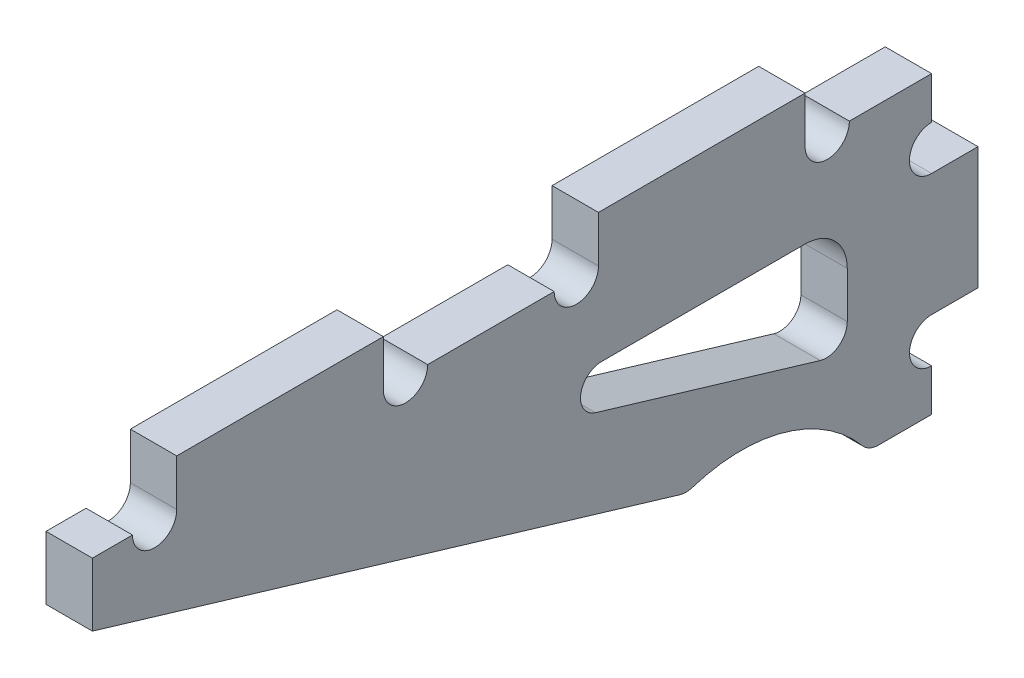
from build123d import *

# Parameters (mm, degrees)
EXTRUDE_1_DEPTH = 2.2
FILLET_1_R      = 2
FILLET_2_R      = 1


with BuildPart() as part:
    # 草图1 → 凸台-拉伸1 (new body)
    with BuildSketch(Plane(origin=(0, 0, 0), x_dir=(0, 0, -1), z_dir=(1, 0, 0))):
        with BuildLine():
            ThreePointArc((7, -1.1), (5.95, -2.15), (4.9, -1.1))
            Line((4.9, -1.1), (4.9, 1.1))
            Line((4.9, 1.1), (-4.9, 1.1))
            Line((-4.9, 1.1), (-4.9, -1.1))
            ThreePointArc((-4.9, -1.1), (-5.95, -2.15), (-7, -1.1))
            Line((-7, -1.1), (-13, -1.1))
            ThreePointArc((-13, -1.1), (-14.05, -2.15), (-15.1, -1.1))
            Line((-15.1, -1.1), (-15.1, 1.1))
            Line((-15.1, 1.1), (-24.9, 1.1))
            Line((-24.9, 1.1), (-24.9, -1.1))
            ThreePointArc((-24.9, -1.1), (-25.95, -2.15), (-27, -1.1))
            Line((-27, -1.1), (-28.9, -1.1))
            Line((-28.9, -1.1), (-28.9, -4.1))
            Line((-28.9, -4.1), (-0.723011959, -12.522469251))
            ThreePointArc((-0.723011959, -12.522469251), (4.018082479, -12.374065966), (7.9, -15.1))
            Line((7.9, -15.1), (10.9, -15.1))
            Line((10.9, -15.1), (10.9, -13.1))
            ThreePointArc((10.9, -13.1), (9.85, -12.05), (10.9, -11))
            Line((10.9, -11), (13.1, -11))
            Line((13.1, -11), (13.1, -5.2))
            Line((13.1, -5.2), (10.9, -5.2))
            ThreePointArc((10.9, -5.2), (9.85, -4.15), (10.9, -3.1))
            Line((10.9, -3.1), (10.9, -1.1))
            Line((10.9, -1.1), (7, -1.1))
        make_face()
        Polygon((6.9, -10.626211615), (-11.587689765, -5.1), (6.9, -5.1), align=None, mode=Mode.SUBTRACT)
    extrude(amount=EXTRUDE_1_DEPTH)

    # 圆角1
    fillet_1_edges = [part.edges().sort_by_distance(p)[0] for p in [
        (1.1, -5.1, -6.9),
    ]]
    fillet(fillet_1_edges, radius=FILLET_1_R)

    # 圆角2
    fillet_2_edges = [part.edges().sort_by_distance(p)[0] for p in [
        (1.1, -5.1, 11.587689765),
        (1.1, -10.626211615, -6.9),
        (1.1, -12.522469251, 0.723011959),
        (1.1, -15.1, -7.9),
    ]]
    fillet(fillet_2_edges, radius=FILLET_2_R)


solid = part.part
